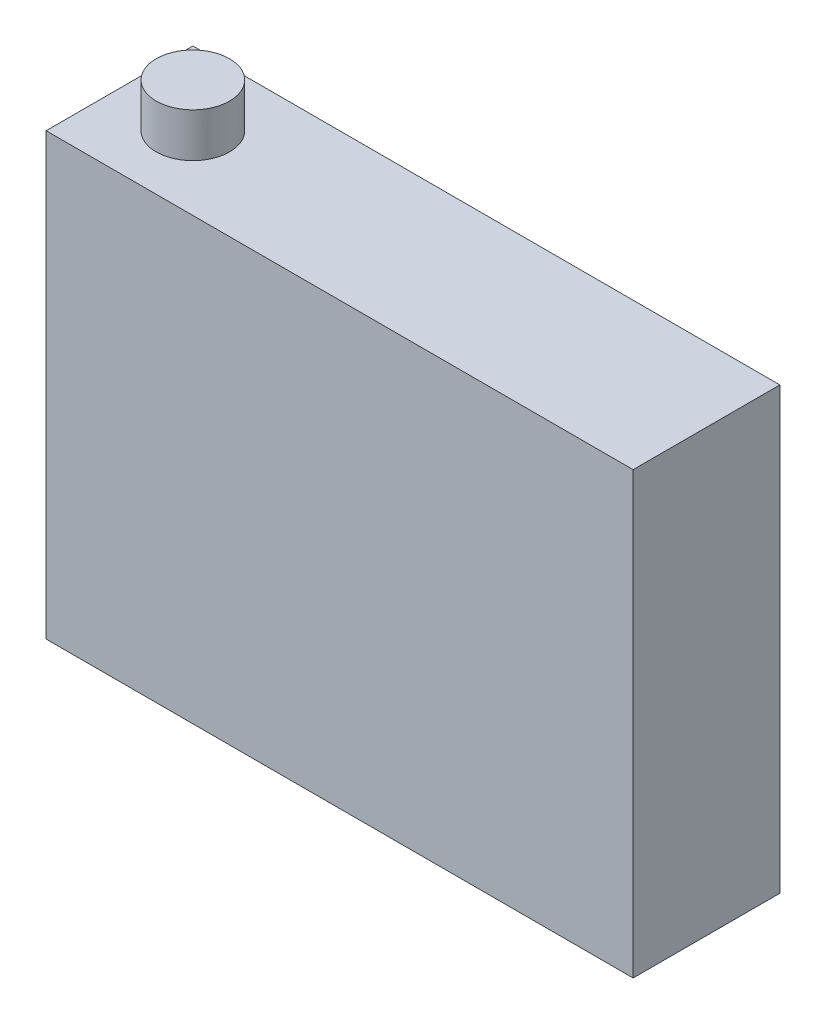
from build123d import *

# Parameters (mm, degrees)
ESQUISSE1_W        = 40
ESQUISSE1_H        = 10
BOSS_EXTRU_1_DEPTH = 30
ESQUISSE2_R        = 2.5
BOSS_EXTRU_2_DEPTH = 3


with BuildPart() as part:
    # Esquisse1 → Boss.-Extru.1 (new body)
    with BuildSketch(Plane(origin=(0, 0, 0), x_dir=(1, 0, 0), z_dir=(0, 1, 0))):
        with Locations((-20, -5)):
            Rectangle(ESQUISSE1_W, ESQUISSE1_H)
    extrude(amount=BOSS_EXTRU_1_DEPTH)

    # Esquisse2 → Boss.-Extru.2 (add)
    with BuildSketch(Plane(origin=(0, 30, 0), x_dir=(1, 0, 0), z_dir=(0, 1, 0))):
        with Locations(Location((-35, -5, 0), (0, 0, 90))):
            Circle(ESQUISSE2_R)
    extrude(amount=BOSS_EXTRU_2_DEPTH)


solid = part.part
